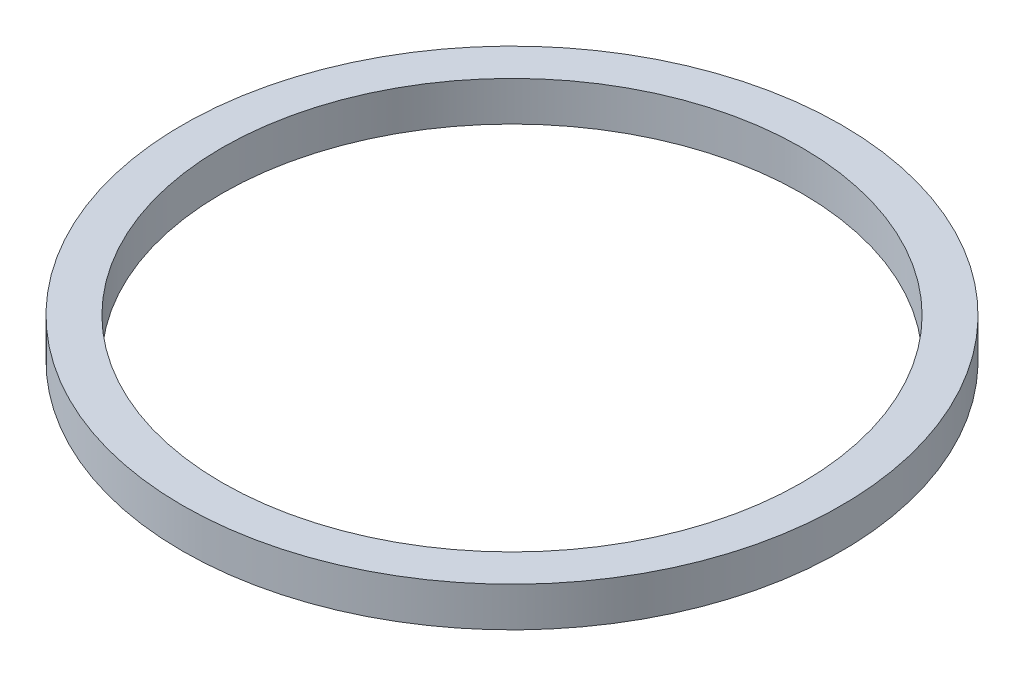
from build123d import *

# Parameters (mm, degrees)
CROQUIS1_R              = 25
CROQUIS1_R_2            = 22
SALIENTE_EXTRUIR1_DEPTH = 3


with BuildPart() as part:
    # Croquis1 → Saliente-Extruir1 (new body)
    with BuildSketch(Plane(origin=(0, 0, 0), x_dir=(1, 0, 0), z_dir=(0, 1, 0))):
        with Locations(Location((0, 0, 0), (0, 0, 270))):
            Circle(CROQUIS1_R)
        with Locations(Location((0, 0, 0), (0, 0, 270))):
            Circle(CROQUIS1_R_2, mode=Mode.SUBTRACT)
    extrude(amount=SALIENTE_EXTRUIR1_DEPTH)


solid = part.part
